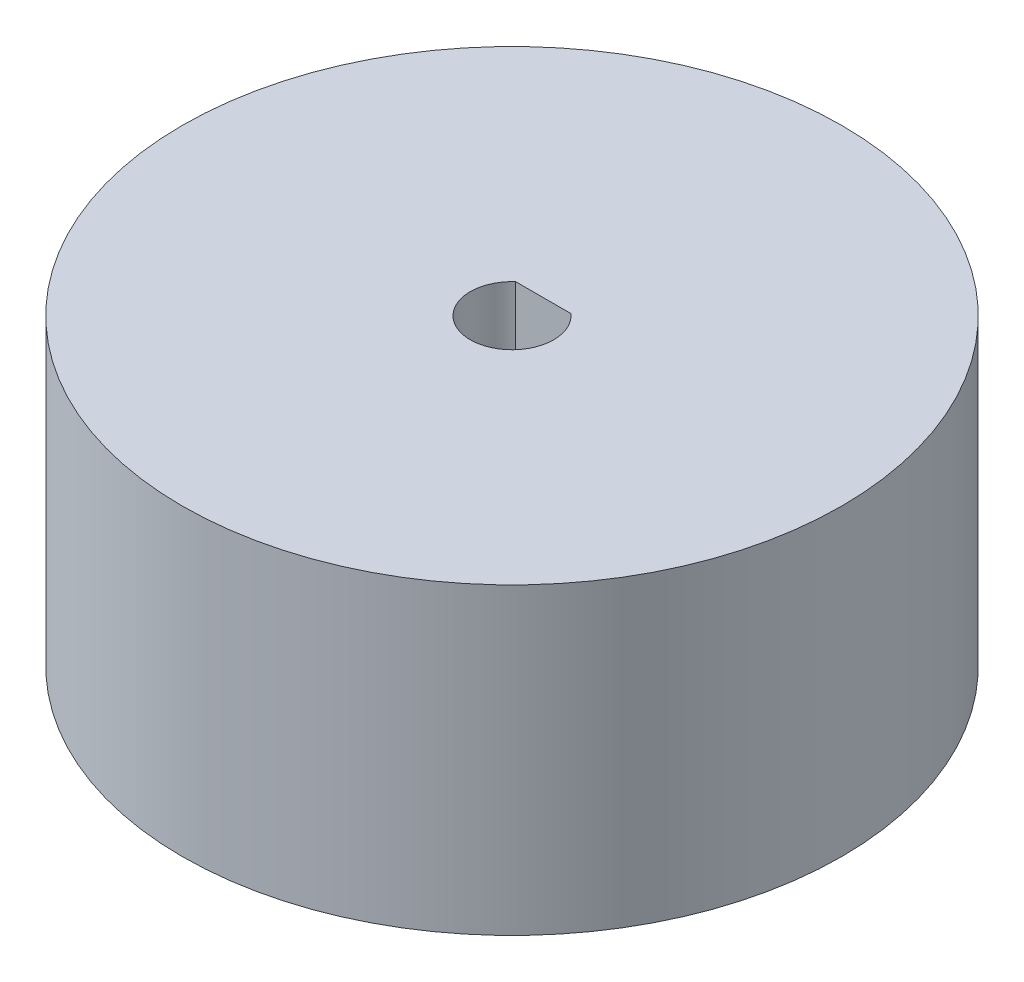
from build123d import *

# Parameters (mm, degrees)
SKETCH5_R           = 17.375
BOSS_EXTRUDE3_DEPTH = 16


with BuildPart() as part:
    # Sketch5 → Boss-Extrude3 (new body)
    with BuildSketch(Plane(origin=(0, 0, 0), x_dir=(1, 0, 0), z_dir=(0, 1, 0))):
        with Locations(Location((0, 0, 0), (0, 0, 270))):
            Circle(SKETCH5_R)
        with BuildLine():
            Line((-1.455163221, 1.65), (1.455163221, 1.65))
            ThreePointArc((1.455163221, 1.65), (0, -2.2), (-1.455163221, 1.65))
        make_face(mode=Mode.SUBTRACT)
    extrude(amount=BOSS_EXTRUDE3_DEPTH)


solid = part.part
